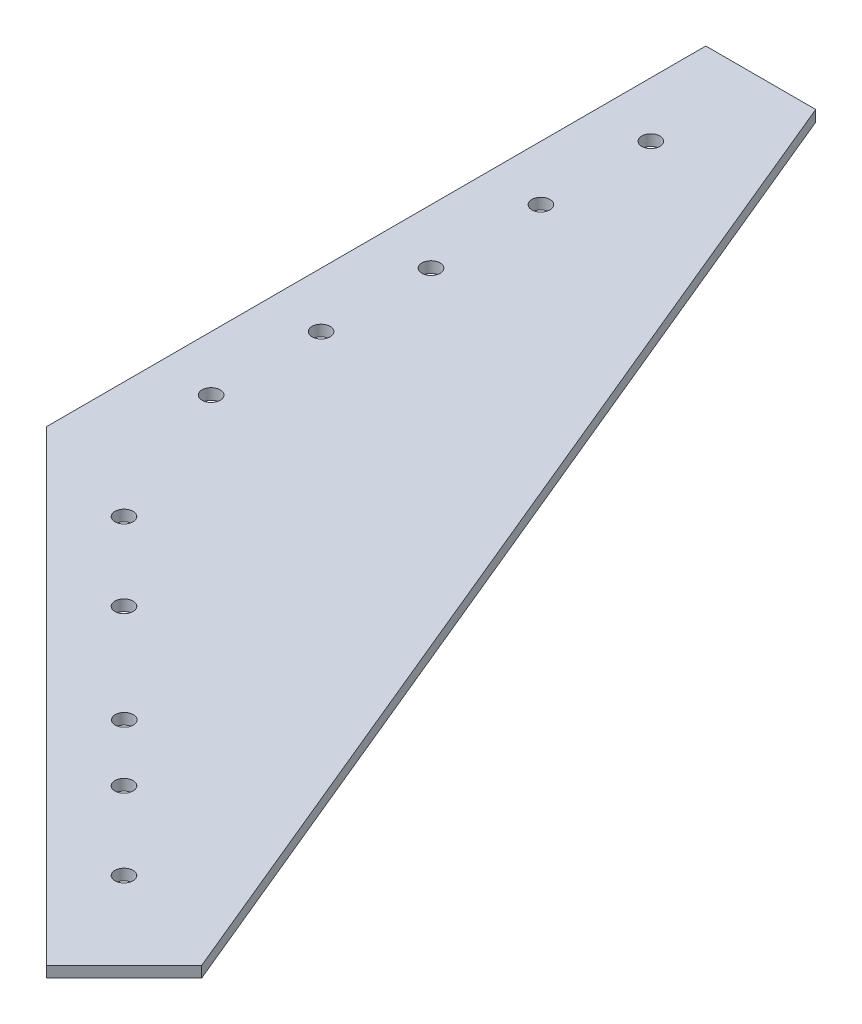
from build123d import *

# Parameters (mm, degrees)
BOSS_EXTRUDE1_DEPTH        = 2.54
F_8_0_199_DIAMETER_HOLE1_D = 4.191


with BuildPart() as part:
    # Sketch1 → Boss-Extrude1 (new body)
    with BuildSketch(Plane(origin=(0, 0, 0), x_dir=(1, 0, 0), z_dir=(0, 1, 0))):
        Polygon((0, 0), (0, -152.4), (107.763073453, -260.163073453), (125.723585695, -242.202561211), (25.4, 0), align=None)
    extrude(amount=BOSS_EXTRUDE1_DEPTH)

    # #8 (0.199) Diameter Hole1 (through all)
    with Locations(Plane(origin=(0, 2.54, 0), x_dir=(1, 0, 0), z_dir=(0, 1, 0))):
        with Locations((12.7, -25.4), (12.7, -50.8), (12.7, -76.2), (12.7, -101.6), (12.7, -127), (26.940768363, -161.380256121), (44.901280605, -179.340768363), (67.655118698, -202.03150109), (80.82230509, -215.261792847), (98.782817332, -233.22230509)):
            Hole(F_8_0_199_DIAMETER_HOLE1_D / 2)


solid = part.part
